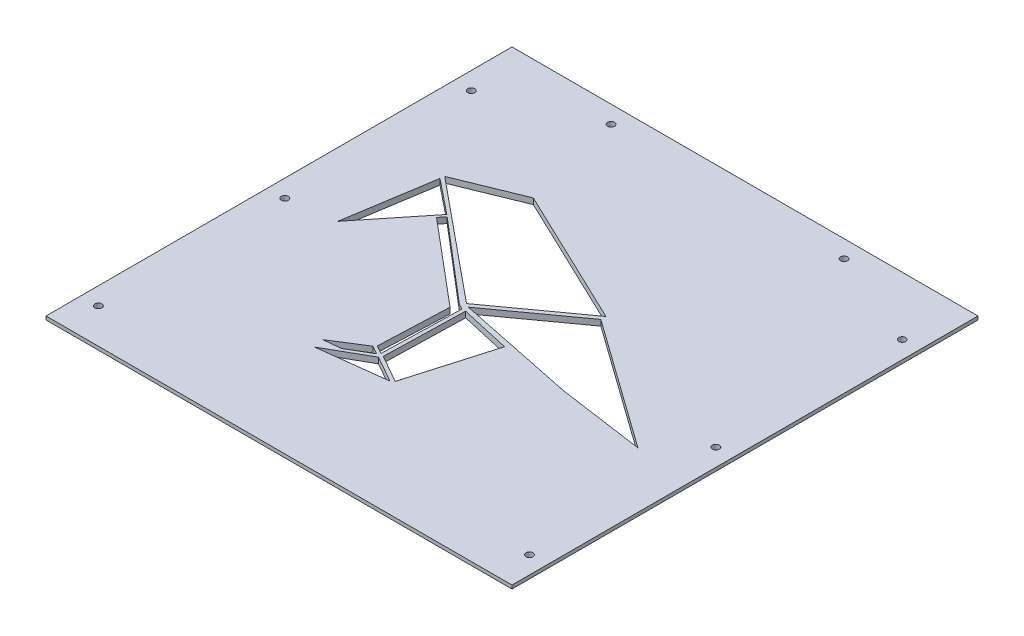
from build123d import *

# Parameters (mm, degrees)
CROQUIS1_W              = 400
CROQUIS1_H              = 400
CROQUIS1_R              = 3
SALIENTE_EXTRUIR1_DEPTH = 5
CHAFL_N1_SIZE           = 2
CORTAR_EXTRUIR1_DEPTH   = 10


with BuildPart() as part:
    # Croquis1 → Saliente-Extruir1 (new body)
    with BuildSketch(Plane(origin=(0, 0, 0), x_dir=(1, 0, 0), z_dir=(0, 1, 0))):
        with Locations((11.673151751, -29.571984436)):
            Rectangle(CROQUIS1_W, CROQUIS1_H)
        with Locations(Location((-173.326848249, 120.428015564, 0), (0, 0, 270))):
            Circle(CROQUIS1_R, mode=Mode.SUBTRACT)
        with Locations(Location((-173.326848249, -199.571984436, 0), (0, 0, 270))):
            Circle(CROQUIS1_R, mode=Mode.SUBTRACT)
        with Locations(Location((196.673151751, -199.571984436, 0), (0, 0, 270))):
            Circle(CROQUIS1_R, mode=Mode.SUBTRACT)
        with Locations(Location((196.673151751, 120.428015564, 0), (0, 0, 270))):
            Circle(CROQUIS1_R, mode=Mode.SUBTRACT)
        with Locations(Location((-173.326848249, -39.571984436, 0), (0, 0, 270))):
            Circle(CROQUIS1_R, mode=Mode.SUBTRACT)
        with Locations(Location((196.673151751, -39.571984436, 0), (0, 0, 270))):
            Circle(CROQUIS1_R, mode=Mode.SUBTRACT)
        with Locations(Location((-88.326848249, 155.428015564, 0), (0, 0, 270))):
            Circle(CROQUIS1_R, mode=Mode.SUBTRACT)
        with Locations(Location((111.673151751, 155.428015564, 0), (0, 0, 270))):
            Circle(CROQUIS1_R, mode=Mode.SUBTRACT)
    extrude(amount=SALIENTE_EXTRUIR1_DEPTH)

    # Chaflán1
    chafl_n1_edges = [part.edges().sort_by_distance(p)[0] for p in [
        (11.673151751, 0, -170.428015564),
        (211.673151751, 0, 29.571984436),
        (11.673151751, 0, 229.571984436),
        (-188.326848249, 0, 29.571984436),
    ]]
    chamfer(chafl_n1_edges, length=CHAFL_N1_SIZE)

    # Croquis2 → Cortar-Extruir1 (cut)
    with BuildSketch(Plane(origin=(0, 5, 0), x_dir=(1, 0, 0), z_dir=(0, 1, 0))):
        Polygon((-91.777504567, 17.93962644), (-133.486350664, -34.097124404), (-121.499339941, 41.762471587), align=None)
        Polygon((-120.940367697, 45.29991804), (-66.966286679, 67.345973172), (52.354078092, 10.388168385), (-17.091461921, -39.85772233), align=None)
        Polygon((163.775185266, -73.593412395), (52.354078092, 6.009139456), (-13.604376997, -41.724802745), (89.090925469, -62.956955386), align=None)
        Polygon((31.311804468, -55.660536224), (10.169460209, -128.358580052), (-13.558867473, -114.834434958), (-11.835173214, -45.882080038), align=None)
        Polygon((7.646392173, -130.362582514), (-49.989323249, -137.40209781), (-15.003820451, -117.452917491), align=None)
        Polygon((-94.005890503, 11.316220426), (-21.421222894, -49.654322149), (-23.868784692, -109.619586204), (-16.697922209, -113.650656174), (-15.003820451, -45.882080038), (-19.79537186, -43.31560542), (-89.832558674, 16.28451972), align=None)
        Polygon((-25.572304789, -111.697520158), (-51.931593577, -128.358580052), (-37.17095608, -126.84931671), (-18.323489891, -115.772410748), align=None)
    extrude(amount=-CORTAR_EXTRUIR1_DEPTH, mode=Mode.SUBTRACT)


solid = part.part
